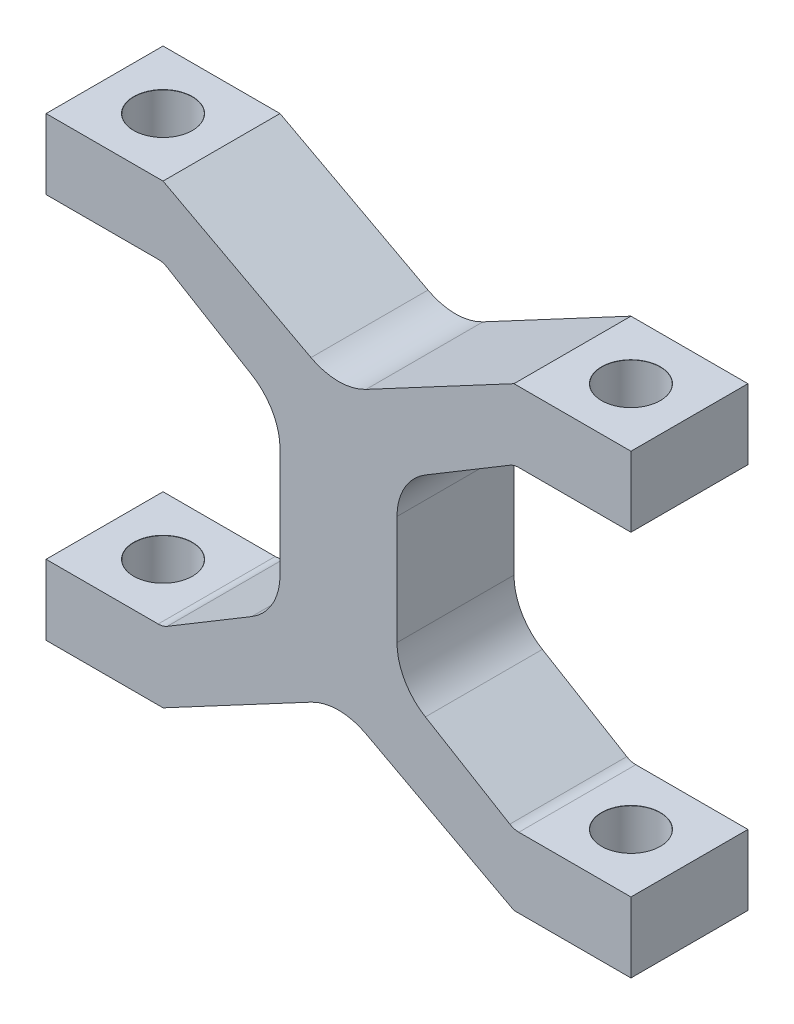
from build123d import *

# Parameters (mm, degrees)
BOSS_EXTRUDE1_DEPTH                        = 10
FILLET1_R                                  = 10
F_10_0MM_DOWEL_HOLE1_D                     = 10
F_10_0MM_DOWEL_HOLE1_DEPTH                 = 24.5
F_10_0MM_DOWEL_HOLE1_CSINK_D               = 10.05
F_10_0MM_DOWEL_HOLE1_CSINK_ANGLE           = 90
F_10_0MM_DOWEL_HOLE1_TIP                   = 3.004303095
F_10_0MM_DOWEL_HOLE1_ON_FACE_2_D           = 10
F_10_0MM_DOWEL_HOLE1_ON_FACE_2_DEPTH       = 24.5
F_10_0MM_DOWEL_HOLE1_ON_FACE_2_CSINK_D     = 10.05
F_10_0MM_DOWEL_HOLE1_ON_FACE_2_CSINK_ANGLE = 90
F_10_0MM_DOWEL_HOLE1_ON_FACE_2_TIP         = 3.004303095
FILLET2_R                                  = 3


with BuildPart() as part:
    # Sketch1 → Boss-Extrude1 (new, symmetric)
    with BuildSketch(Plane.XY):
        Polygon((-50, 27), (-50, 39), (-30, 39), (0, 23), (30, 39), (50, 39), (50, 27), (30, 27), (10, 15), (10, -15), (30, -27), (50, -27), (50, -39), (30, -39), (0, -23), (-30, -39), (-50, -39), (-50, -27), (-30, -27), (-10, -15), (-10, 15), (-30, 27), align=None)
    extrude(amount=BOSS_EXTRUDE1_DEPTH, both=True)

    # Fillet1
    fillet1_edges = [part.edges().sort_by_distance(p)[0] for p in [
        (-10, 15, 0),
        (0, 23, 0),
        (10, 15, 0),
        (10, -15, 0),
        (0, -23, 0),
        (-10, -15, 0),
    ]]
    fillet(fillet1_edges, radius=FILLET1_R)

    # Ø10.0mm Dowel Hole1
    with Locations(Plane(origin=(-40, 39, 0), x_dir=(1, 0, 0), z_dir=(0, 1, 0))):
        with Locations((0, 0), (80, 0)):
            CounterSinkHole(F_10_0MM_DOWEL_HOLE1_D / 2, F_10_0MM_DOWEL_HOLE1_CSINK_D / 2, depth=F_10_0MM_DOWEL_HOLE1_DEPTH, counter_sink_angle=F_10_0MM_DOWEL_HOLE1_CSINK_ANGLE)
            with Locations((0, 0, -(F_10_0MM_DOWEL_HOLE1_DEPTH + F_10_0MM_DOWEL_HOLE1_TIP / 2))):  # 118° drill point
                Cone(0, F_10_0MM_DOWEL_HOLE1_D / 2, F_10_0MM_DOWEL_HOLE1_TIP, mode=Mode.SUBTRACT)

    # Ø10.0mm Dowel Hole1 on face 2
    with Locations(Plane(origin=(-40, -27, 0), x_dir=(0, 0, 1), z_dir=(0, 1, 0))):
        with Locations((0, 0), (0, 80)):
            CounterSinkHole(F_10_0MM_DOWEL_HOLE1_ON_FACE_2_D / 2, F_10_0MM_DOWEL_HOLE1_ON_FACE_2_CSINK_D / 2, depth=F_10_0MM_DOWEL_HOLE1_ON_FACE_2_DEPTH, counter_sink_angle=F_10_0MM_DOWEL_HOLE1_ON_FACE_2_CSINK_ANGLE)
            with Locations((0, 0, -(F_10_0MM_DOWEL_HOLE1_ON_FACE_2_DEPTH + F_10_0MM_DOWEL_HOLE1_ON_FACE_2_TIP / 2))):  # 118° drill point
                Cone(0, F_10_0MM_DOWEL_HOLE1_ON_FACE_2_D / 2, F_10_0MM_DOWEL_HOLE1_ON_FACE_2_TIP, mode=Mode.SUBTRACT)

    # Fillet2
    fillet2_edges = [part.edges().sort_by_distance(p)[0] for p in [
        (-30, 27, 0),
        (30, 27, 0),
        (30, -27, 0),
        (-30, -27, 0),
    ]]
    fillet(fillet2_edges, radius=FILLET2_R)


solid = part.part
